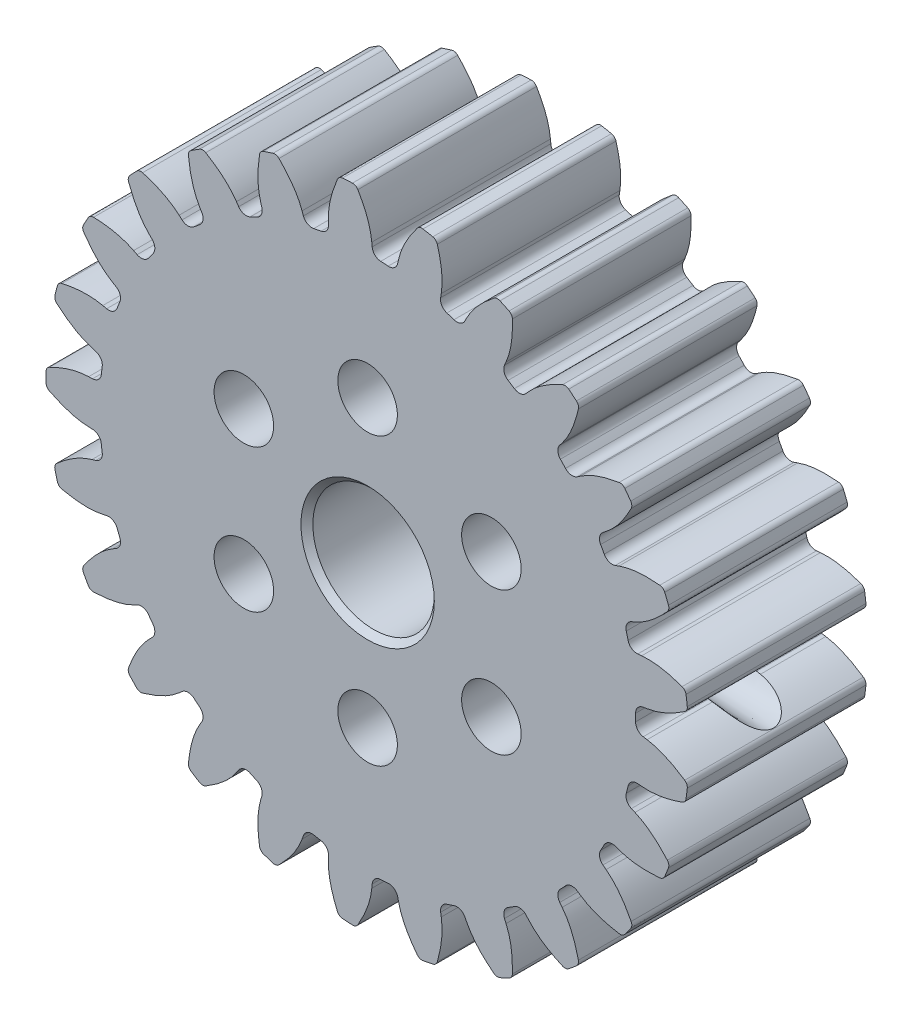
from build123d import *

# Parameters (mm, degrees)
EXTRUDE_1_DEPTH          = 15
SKETCH_2_R               = 5.1
CUT_EXTRUDE_1_DEPTH      = 42.004926924
CUT_EXTRUDE_2_DEPTH      = 42.004926924
CUT_EXTRUDE_2_DEPTH_BACK = 10
SKETCH_3_R               = 1.4
SKETCH_4_R               = 1.6
CUT_EXTRUDE_3_DEPTH      = 49.180950946
CUT_EXTRUDE_3_DRAFT      = -3
CHAMFER_1_SIZE           = 0.5
SKETCH_5_R               = 2.5
CUT_EXTRUDE_4_DEPTH      = 42.004926924


with BuildPart() as part:
    # Model → 凸台-拉伸1 (new body)
    with BuildSketch(Plane.XY):
        with BuildLine():
            Line((22.679018285, 4.714328783), (23.00803201, 4.745455879))
            add(Edge.make_bspline(
                [(23.00803201, 4.745455879), (23.302660102, 4.773329845), (23.909366678, 4.779909718), (24.828242862, 4.659026535), (25.662825858, 4.450786507), (26.186283476, 4.27883704), (26.403196442, 4.201915887)],
                knots=[0, 0, 0, 0, 0.887831086, 1.811652672, 2.7734525, 3.463896477, 3.463896477, 3.463896477, 3.463896477], degree=3))
            ThreePointArc((26.403196442, 4.201915887), (26.623093745, 4.047250157), (26.731104521, 3.801059205))
            ThreePointArc((26.731104521, 3.801059205), (26.759913246, 3.59263734), (26.787096935, 3.383997306))
            ThreePointArc((26.787096935, 3.383997306), (26.812653946, 3.175151711), (26.836582716, 2.966113299))
            ThreePointArc((26.836582716, 2.966113299), (26.793190457, 2.700795771), (26.618665461, 2.496302971))
            add(Edge.make_bspline(
                [(23.465339263, 1.125496228), (23.757643045, 1.171769001), (24.346925166, 1.316277637), (25.206870739, 1.661878267), (25.963446587, 2.071128403), (26.427696728, 2.367854377), (26.618665461, 2.496302971)],
                knots=[0, 0, 0, 0, 0.887831086, 1.811652672, 2.7734525, 3.463896477, 3.463896477, 3.463896477, 3.463896477], degree=3))
            Line((23.465339263, 1.125496228), (23.138921114, 1.073823023))
            ThreePointArc((23.138921114, 1.073823023), (22.676450538, 0.812749154), (22.497828137, 0.312616534))
            ThreePointArc((22.497828137, 0.312616534), (22.499457028, 0.156312039), (22.5, 0))
            ThreePointArc((22.5, 0), (22.499457045, -0.156309633), (22.497828204, -0.312611722))
            ThreePointArc((22.497828204, -0.312611722), (22.676448988, -0.812747314), (23.138921114, -1.073823023))
            Line((23.138921114, -1.073823023), (23.465339263, -1.125496228))
            add(Edge.make_bspline(
                [(23.465339263, -1.125496228), (23.757643045, -1.171769001), (24.346925166, -1.316277637), (25.206870739, -1.661878267), (25.963446587, -2.071128403), (26.427696728, -2.367854377), (26.618665461, -2.496302971)],
                knots=[0, 0, 0, 0, 0.887831086, 1.811652672, 2.7734525, 3.463896477, 3.463896477, 3.463896477, 3.463896477], degree=3))
            ThreePointArc((26.618665461, -2.496302971), (26.793190484, -2.700795829), (26.836582702, -2.966113426))
            ThreePointArc((26.836582702, -2.966113426), (26.812653938, -3.175151774), (26.787096935, -3.383997306))
            ThreePointArc((26.787096935, -3.383997306), (26.759913238, -3.592637403), (26.731104503, -3.801059332))
            ThreePointArc((26.731104503, -3.801059332), (26.623093705, -4.047250207), (26.403196442, -4.201915887))
            add(Edge.make_bspline(
                [(23.00803201, -4.745455879), (23.302660102, -4.773329845), (23.909366678, -4.779909718), (24.828242862, -4.659026535), (25.662825858, -4.450786507), (26.186283476, -4.27883704), (26.403196442, -4.201915887)],
                knots=[0, 0, 0, 0, 0.887831086, 1.811652672, 2.7734525, 3.463896477, 3.463896477, 3.463896477, 3.463896477], degree=3))
            Line((23.00803201, -4.745455879), (22.679018285, -4.714328783))
            ThreePointArc((22.679018285, -4.714328783), (22.16615064, -4.852188781), (21.868762066, -5.29218723))
            ThreePointArc((21.868762066, -5.29218723), (21.831468435, -5.44398622), (21.793121125, -5.595522461))
            ThreePointArc((21.793121125, -5.595522461), (21.753722603, -5.746786312), (21.713274187, -5.897772808))
            ThreePointArc((21.713274187, -5.897772808), (21.761904606, -6.426616902), (22.144920432, -6.794502579))
            Line((22.144920432, -6.794502579), (22.44823295, -6.925729268))
            add(Edge.make_bspline(
                [(22.44823295, -6.925729268), (22.719845901, -7.043241292), (23.254676804, -7.329758426), (24.001658224, -7.878361145), (24.63268848, -8.462906698), (25.0085606, -8.865764794), (25.161585833, -9.037669933)],
                knots=[0, 0, 0, 0, 0.887831086, 1.811652672, 2.7734525, 3.463896477, 3.463896477, 3.463896477, 3.463896477], degree=3))
            ThreePointArc((25.161585833, -9.037669933), (25.279772526, -9.279140879), (25.255819694, -9.546914243))
            ThreePointArc((25.255819694, -9.546914243), (25.180656973, -9.743434425), (25.103965119, -9.939362922))
            ThreePointArc((25.103965119, -9.939362922), (25.025748765, -10.134687896), (24.946012684, -10.329397426))
            ThreePointArc((24.946012684, -10.329397426), (24.780170063, -10.540992568), (24.528717485, -10.636112917))
            add(Edge.make_bspline(
                [(21.105045488, -10.318233541), (21.383485324, -10.418502822), (21.969494749, -10.575757766), (22.889565173, -10.687187565), (23.749715399, -10.693042131), (24.299489727, -10.656673389), (24.528717485, -10.636112917)],
                knots=[0, 0, 0, 0, 0.887831086, 1.811652672, 2.7734525, 3.463896477, 3.463896477, 3.463896477, 3.463896477], degree=3))
            Line((21.105045488, -10.318233541), (20.794109328, -10.206261973))
            ThreePointArc((20.794109328, -10.206261973), (20.263069977, -10.212245849), (19.865601247, -10.564463407))
            ThreePointArc((19.865601247, -10.564463407), (19.79172839, -10.702218804), (19.716900301, -10.839457667))
            ThreePointArc((19.716900301, -10.839457667), (19.641121765, -10.976171272), (19.564395296, -11.112355137))
            ThreePointArc((19.564395296, -11.112355137), (19.479979723, -11.636678516), (19.759472955, -12.08825855))
            Line((19.759472955, -12.08825855), (20.020621603, -12.290793267))
            add(Edge.make_bspline(
                [(20.020621603, -12.290793267), (20.254477281, -12.472160828), (20.701251574, -12.882683537), (21.288333251, -13.599817618), (21.754167964, -14.32292944), (22.018044635, -14.806606604), (22.12351123, -15.011166854)],
                knots=[0, 0, 0, 0, 0.887831086, 1.811652672, 2.7734525, 3.463896477, 3.463896477, 3.463896477, 3.463896477], degree=3))
            ThreePointArc((22.12351123, -15.011166854), (22.177933487, -15.274443382), (22.088140651, -15.527847327))
            ThreePointArc((22.088140651, -15.527847327), (21.966466723, -15.699501257), (21.843458848, -15.870201812))
            ThreePointArc((21.843458848, -15.870201812), (21.719124459, -16.039938676), (21.593471142, -16.208701491))
            ThreePointArc((21.593471142, -16.208701491), (21.3802172, -16.3724056), (21.113008999, -16.402003855))
            add(Edge.make_bspline(
                [(17.87595134, -15.242678642), (18.12070752, -15.40904295), (18.649198667, -15.707092058), (19.512651923, -16.043833295), (20.344322976, -16.263414592), (20.88586967, -16.364911757), (21.113008999, -16.402003855)],
                knots=[0, 0, 0, 0, 0.887831086, 1.811652672, 2.7734525, 3.463896477, 3.463896477, 3.463896477, 3.463896477], degree=3))
            Line((17.87595134, -15.242678642), (17.602630008, -15.056898188))
            ThreePointArc((17.602630008, -15.056898188), (17.086786105, -14.930629953), (16.614211641, -15.172935495))
            ThreePointArc((16.614211641, -15.172935495), (16.508401261, -15.287991621), (16.401794117, -15.402309883))
            ThreePointArc((16.401794117, -15.402309883), (16.294397013, -15.515883023), (16.186213496, -15.628707325))
            ThreePointArc((16.186213496, -15.628707325), (15.974056072, -16.115564821), (16.132465122, -16.622464779))
            Line((16.132465122, -16.622464779), (16.335040969, -16.883581522))
            add(Edge.make_bspline(
                [(16.335040969, -16.883581522), (16.516445363, -17.117408631), (16.847090573, -17.626142263), (17.237384007, -18.466747533), (17.508753068, -19.28298985), (17.644053949, -19.817094866), (17.695335051, -20.041456955)],
                knots=[0, 0, 0, 0, 0.887831086, 1.811652672, 2.7734525, 3.463896477, 3.463896477, 3.463896477, 3.463896477], degree=3))
            ThreePointArc((17.695335051, -20.041456955), (17.682573323, -20.309996432), (17.532582495, -20.533108655))
            ThreePointArc((17.532582495, -20.533108655), (17.372042581, -20.669110686), (17.210447723, -20.803857555))
            ThreePointArc((17.210447723, -20.803857555), (17.047807686, -20.937341118), (16.884132394, -21.06955323))
            ThreePointArc((16.884132394, -21.06955323), (16.63686666, -21.175080174), (16.370692509, -21.137296568))
            add(Edge.make_bspline(
                [(13.523645425, -19.209370184), (13.719339019, -19.431376239), (14.157104845, -19.85149199), (14.909686989, -20.392385974), (15.660621919, -20.811896902), (16.15991361, -21.044882532), (16.370692509, -21.137296568)],
                knots=[0, 0, 0, 0, 0.887831086, 1.811652672, 2.7734525, 3.463896477, 3.463896477, 3.463896477, 3.463896477], degree=3))
            Line((13.523645425, -19.209370184), (13.305112706, -18.961454114))
            ThreePointArc((13.305112706, -18.961454114), (12.83687662, -18.710867666), (12.318890015, -18.828036244))
            ThreePointArc((12.318890015, -18.828036244), (12.187790568, -18.913163698), (12.056102887, -18.997378324))
            ThreePointArc((12.056102887, -18.997378324), (11.923835369, -19.080674781), (11.790992374, -19.163050353))
            ThreePointArc((11.790992374, -19.163050353), (11.464423729, -19.58185092), (11.491795174, -20.112220412))
            Line((11.491795174, -20.112220412), (11.623069635, -20.415512257))
            add(Edge.make_bspline(
                [(11.623069635, -20.415512257), (11.740624439, -20.687106696), (11.934364913, -21.262085645), (12.10334653, -22.173343785), (12.163198824, -23.03142909), (12.161422463, -23.582402176), (12.155295892, -23.812468609)],
                knots=[0, 0, 0, 0, 0.887831086, 1.811652672, 2.7734525, 3.463896477, 3.463896477, 3.463896477, 3.463896477], degree=3))
            ThreePointArc((12.155295892, -23.812468609), (12.076152045, -24.069397711), (11.875387701, -24.248199251))
            ThreePointArc((11.875387701, -24.248199251), (11.686069114, -24.340003876), (11.496040872, -24.430330417))
            ThreePointArc((11.496040872, -24.430330417), (11.305314458, -24.519173416), (11.113901512, -24.606527451))
            ThreePointArc((11.113901512, -24.606527451), (10.848160602, -24.647246585), (10.599745202, -24.544455201))
            add(Edge.make_bspline(
                [(8.321599132, -21.969066351), (8.455933992, -22.232764695), (8.775468061, -22.748549672), (9.369891589, -23.459610045), (9.992906392, -24.052691188), (10.418570746, -24.402525941), (10.599745202, -24.544455201)],
                knots=[0, 0, 0, 0, 0.887831086, 1.811652672, 2.7734525, 3.463896477, 3.463896477, 3.463896477, 3.463896477], degree=3))
            Line((8.321599132, -21.969066351), (8.17158624, -21.674592143))
            ThreePointArc((8.17158624, -21.674592143), (7.780378967, -21.315432749), (7.249527223, -21.300102231))
            ThreePointArc((7.249527223, -21.300102231), (7.101376169, -21.349952143), (6.952882373, -21.398771617))
            ThreePointArc((6.952882373, -21.398771617), (6.804055296, -21.446557568), (6.654899836, -21.493308451))
            ThreePointArc((6.654899836, -21.493308451), (6.23443948, -21.817737308), (6.129053472, -22.338251269))
            Line((6.129053472, -22.338251269), (6.18077809, -22.664661274))
            add(Edge.make_bspline(
                [(6.18077809, -22.664661274), (6.227096903, -22.956957765), (6.271759213, -23.56205399), (6.208811278, -24.486707299), (6.053386064, -25.332718936), (5.914644077, -25.865940426), (5.851494788, -26.087255283)],
                knots=[0, 0, 0, 0, 0.887831086, 1.811652672, 2.7734525, 3.463896477, 3.463896477, 3.463896477, 3.463896477], degree=3))
            ThreePointArc((5.851494788, -26.087255283), (5.710941721, -26.316430211), (5.472018624, -26.43968631))
            ThreePointArc((5.472018624, -26.43968631), (5.265816946, -26.481525105), (5.059295494, -26.52175577))
            ThreePointArc((5.059295494, -26.52175577), (4.852466745, -26.560375872), (4.645343324, -26.597383056))
            ThreePointArc((4.645343324, -26.597383056), (4.377824716, -26.570735846), (4.162776921, -26.409395445))
            add(Edge.make_bspline(
                [(2.596676161, -23.348365283), (2.661211533, -23.637186779), (2.842436343, -24.216232314), (3.241351439, -25.052780538), (3.697299804, -25.782166428), (4.022590764, -26.226868899), (4.162776921, -26.409395445)],
                knots=[0, 0, 0, 0, 0.887831086, 1.811652672, 2.7734525, 3.463896477, 3.463896477, 3.463896477, 3.463896477], degree=3))
            Line((2.596676161, -23.348365283), (2.524608957, -23.025835834))
            ThreePointArc((2.524608957, -23.025835834), (2.23501149, -22.580670801), (1.724649974, -22.433804458))
            ThreePointArc((1.724649974, -22.433804458), (1.568756189, -22.445244575), (1.412786689, -22.45560139))
            ThreePointArc((1.412786689, -22.45560139), (1.256751405, -22.464874269), (1.100655467, -22.473062932))
            ThreePointArc((1.100655467, -22.473062932), (0.61272247, -22.682735021), (0.381200799, -23.160687645))
            Line((0.381200799, -23.160687645), (0.350125525, -23.489706269))
            add(Edge.make_bspline(
                [(0.350125525, -23.489706269), (0.322297967, -23.784338748), (0.215075817, -24.381531827), (-0.07584642, -25.261480938), (-0.436783204, -26.042260885), (-0.703773149, -26.524226512), (-0.819977254, -26.722883766)],
                knots=[0, 0, 0, 0, 0.887831086, 1.811652672, 2.7734525, 3.463896477, 3.463896477, 3.463896477, 3.463896477], degree=3))
            ThreePointArc((-0.819977254, -26.722883766), (-1.013108075, -26.909904616), (-1.275177509, -26.96987064))
            ThreePointArc((-1.275177509, -26.96987064), (-1.485305867, -26.95911472), (-1.695344027, -26.946721668))
            ThreePointArc((-1.695344027, -26.946721668), (-1.905279299, -26.932692231), (-2.11509887, -26.917027265))
            ThreePointArc((-2.11509887, -26.917027265), (-2.367585998, -26.824688054), (-2.535753944, -26.614936246))
            add(Edge.make_bspline(
                [(-3.291405523, -23.260600555), (-3.300724634, -23.556397487), (-3.269196103, -24.162320019), (-3.090854742, -25.071792692), (-2.830621728, -25.89165333), (-2.626143389, -26.403281228), (-2.535753944, -26.614936246)],
                knots=[0, 0, 0, 0, 0.887831086, 1.811652672, 2.7734525, 3.463896477, 3.463896477, 3.463896477, 3.463896477], degree=3))
            Line((-3.291405523, -23.260600555), (-3.280998791, -22.930281576))
            ThreePointArc((-3.280998791, -22.930281576), (-3.45078998, -22.42708226), (-3.908593376, -22.157908246))
            ThreePointArc((-3.908593376, -22.157908246), (-4.062434512, -22.130219742), (-4.216079578, -22.101463141))
            ThreePointArc((-4.216079578, -22.101463141), (-4.369518798, -22.071640299), (-4.522747133, -22.040752219))
            ThreePointArc((-4.522747133, -22.040752219), (-5.047494146, -22.122493072), (-5.390604122, -22.527852837))
            Line((-5.390604122, -22.527852837), (-5.502526713, -22.838806629))
            add(Edge.make_bspline(
                [(-5.502526713, -22.838806629), (-5.602752136, -23.117262255), (-5.855121584, -23.669028351), (-6.35573841, -24.448982824), (-6.899507777, -25.115471805), (-7.27796972, -25.515897896), (-7.439927109, -25.679415182)],
                knots=[0, 0, 0, 0, 0.887831086, 1.811652672, 2.7734525, 3.463896477, 3.463896477, 3.463896477, 3.463896477], degree=3))
            ThreePointArc((-7.439927109, -25.679415182), (-7.673500564, -25.812530746), (-7.942249549, -25.805438809))
            ThreePointArc((-7.942249549, -25.805438809), (-8.143101449, -25.742764008), (-8.343458848, -25.67852594))
            ThreePointArc((-8.343458848, -25.67852594), (-8.543309638, -25.612728485), (-8.742641623, -25.545375657))
            ThreePointArc((-8.742641623, -25.545375657), (-8.964232575, -25.393146457), (-9.074954063, -25.14816272))
            add(Edge.make_bspline(
                [(-8.972676093, -21.711286747), (-9.055264133, -21.995473105), (-9.175412935, -22.590200294), (-9.228851152, -23.515451904), (-9.180684886, -24.374272431), (-9.109867294, -24.920678293), (-9.074954063, -25.14816272)],
                knots=[0, 0, 0, 0, 0.887831086, 1.811652672, 2.7734525, 3.463896477, 3.463896477, 3.463896477, 3.463896477], degree=3))
            Line((-8.972676093, -21.711286747), (-8.880449319, -21.393933395))
            ThreePointArc((-8.880449319, -21.393933395), (-8.919765624, -20.864317659), (-9.296245429, -20.489749167))
            ThreePointArc((-9.296245429, -20.489749167), (-9.438367512, -20.424671814), (-9.58003406, -20.35860868))
            ThreePointArc((-9.58003406, -20.35860868), (-9.721236065, -20.291563995), (-9.861968898, -20.223539983))
            ThreePointArc((-9.861968898, -20.223539983), (-10.390558141, -20.172213522), (-10.823697561, -20.479510183))
            Line((-10.823697561, -20.479510183), (-11.009434962, -20.752860774))
            add(Edge.make_bspline(
                [(-11.009434962, -20.752860774), (-11.175760717, -20.997643155), (-11.557420163, -21.469312775), (-12.23627598, -22.100265202), (-12.928710902, -22.610585263), (-13.394864687, -22.904311575), (-13.592398982, -23.022414499)],
                knots=[0, 0, 0, 0, 0.887831086, 1.811652672, 2.7734525, 3.463896477, 3.463896477, 3.463896477, 3.463896477], degree=3))
            ThreePointArc((-13.592398982, -23.022414499), (-13.851738792, -23.093260637), (-14.11028084, -23.019556351))
            ThreePointArc((-14.11028084, -23.019556351), (-14.28923602, -22.908900759), (-14.467323464, -22.796853989))
            ThreePointArc((-14.467323464, -22.796853989), (-14.644532413, -22.683422811), (-14.820852049, -22.568614147))
            ThreePointArc((-14.820852049, -22.568614147), (-14.997623452, -22.366060079), (-15.043941443, -22.101237642))
            add(Edge.make_bspline(
                [(-14.090160425, -18.797772944), (-14.240828084, -19.052492255), (-14.505104827, -19.598655204), (-14.786964903, -20.481548789), (-14.953891849, -21.325366353), (-15.021184734, -21.872217489), (-15.043941443, -22.101237642)],
                knots=[0, 0, 0, 0, 0.887831086, 1.811652672, 2.7734525, 3.463896477, 3.463896477, 3.463896477, 3.463896477], degree=3))
            Line((-14.090160425, -18.797772944), (-13.921908555, -18.513325698))
            ThreePointArc((-13.921908555, -18.513325698), (-13.828279589, -17.990571247), (-14.099780193, -17.534143792))
            ThreePointArc((-14.099780193, -17.534143792), (-14.22125317, -17.435766639), (-14.342039769, -17.336547962))
            ThreePointArc((-14.342039769, -17.336547962), (-14.462132319, -17.236494098), (-14.581526886, -17.135608354))
            ThreePointArc((-14.581526886, -17.135608354), (-15.080745155, -16.954439609), (-15.576698275, -17.144364586))
            Line((-15.576698275, -17.144364586), (-15.824579922, -17.362936352))
            add(Edge.make_bspline(
                [(-15.824579922, -17.362936352), (-16.04655515, -17.558664912), (-16.533523527, -17.920601318), (-17.347963328, -18.362906638), (-18.145555573, -18.684992494), (-18.670111042, -18.853563121), (-18.890810437, -18.918830844)],
                knots=[0, 0, 0, 0, 0.887831086, 1.811652672, 2.7734525, 3.463896477, 3.463896477, 3.463896477, 3.463896477], degree=3))
            ThreePointArc((-18.890810437, -18.918830844), (-19.159621328, -18.922956031), (-19.391711292, -18.787270509))
            ThreePointArc((-19.391711292, -18.787270509), (-19.537525339, -18.635587021), (-19.68215294, -18.48277186))
            ThreePointArc((-19.68215294, -18.48277186), (-19.825585357, -18.328834258), (-19.967813834, -18.173783609))
            ThreePointArc((-19.967813834, -18.173783609), (-20.08865849, -17.933631889), (-20.067662654, -17.66561052))
            add(Edge.make_bspline(
                [(-18.322308158, -14.703125934), (-18.531588432, -14.912373247), (-18.923387637, -15.375654528), (-19.415959267, -16.160714638), (-19.787490791, -16.936509078), (-19.988665893, -17.44944482), (-20.067662654, -17.66561052)],
                knots=[0, 0, 0, 0, 0.887831086, 1.811652672, 2.7734525, 3.463896477, 3.463896477, 3.463896477, 3.463896477], degree=3))
            Line((-18.322308158, -14.703125934), (-18.088603076, -14.46945766))
            ThreePointArc((-18.088603076, -14.46945766), (-17.86791189, -13.986411078), (-18.017373911, -13.476803677))
            ThreePointArc((-18.017373911, -13.476803677), (-18.110565188, -13.351308122), (-18.202882373, -13.225168177))
            ThreePointArc((-18.202882373, -13.225168177), (-18.29431961, -13.098391886), (-18.384873914, -12.970983431))
            ThreePointArc((-18.384873914, -12.970983431), (-18.823353488, -12.6713559), (-19.35095775, -12.73197551))
            Line((-19.35095775, -12.73197551), (-19.645408326, -12.882034783))
            add(Edge.make_bspline(
                [(-19.645408326, -12.882034783), (-19.909085508, -13.016411176), (-20.470764803, -13.245872574), (-21.36961434, -13.471739117), (-22.222248252, -13.585352927), (-22.772245657, -13.618175958), (-23.002242797, -13.626507467)],
                knots=[0, 0, 0, 0, 0.887831086, 1.811652672, 2.7734525, 3.463896477, 3.463896477, 3.463896477, 3.463896477], degree=3))
            ThreePointArc((-23.002242797, -13.626507467), (-23.263634392, -13.563652505), (-23.454689206, -13.374511365))
            ThreePointArc((-23.454689206, -13.374511365), (-23.558200087, -13.191330815), (-23.660280361, -13.007349201))
            ThreePointArc((-23.660280361, -13.007349201), (-23.76092386, -12.82257764), (-23.86012444, -12.637027408))
            ThreePointArc((-23.86012444, -12.637027408), (-23.917449234, -12.374367653), (-23.830458817, -12.11998812))
            add(Edge.make_bspline(
                [(-21.403197884, -9.684627447), (-21.657940924, -9.835254983), (-22.152644407, -10.186544931), (-22.824977503, -10.824443351), (-23.377768913, -11.483468649), (-23.700185661, -11.930259358), (-23.830458817, -12.11998812)],
                knots=[0, 0, 0, 0, 0.887831086, 1.811652672, 2.7734525, 3.463896477, 3.463896477, 3.463896477, 3.463896477], degree=3))
            Line((-21.403197884, -9.684627447), (-21.118724141, -9.516420382))
            ThreePointArc((-21.118724141, -9.516420382), (-20.784837574, -9.103433263), (-20.802869764, -8.572666422))
            ThreePointArc((-20.802869764, -8.572666422), (-20.86192379, -8.427937812), (-20.919970932, -8.282802435))
            ThreePointArc((-20.919970932, -8.282802435), (-20.977007519, -8.137269539), (-21.033031698, -7.991343916))
            ThreePointArc((-21.033031698, -7.991343916), (-21.383221293, -7.592084299), (-21.909325381, -7.519589588))
            Line((-21.909325381, -7.519589588), (-22.231843475, -7.591707592))
            add(Edge.make_bspline(
                [(-22.231843475, -7.591707592), (-22.520654803, -7.656288455), (-23.121752639, -7.73885694), (-24.04853389, -7.734092681), (-24.902635346, -7.632095673), (-25.443516327, -7.527108715), (-25.668359646, -7.477980512)],
                knots=[0, 0, 0, 0, 0.887831086, 1.811652672, 2.7734525, 3.463896477, 3.463896477, 3.463896477, 3.463896477], degree=3))
            ThreePointArc((-25.668359646, -7.477980512), (-25.90590775, -7.352094807), (-26.043922737, -7.121382484))
            ThreePointArc((-26.043922737, -7.121382484), (-26.098626483, -6.918214778), (-26.15174535, -6.714626953))
            ThreePointArc((-26.15174535, -6.714626953), (-26.20327613, -6.510631311), (-26.253215675, -6.3062403))
            ThreePointArc((-26.253215675, -6.3062403), (-26.24341868, -6.037576387), (-26.09589961, -5.812822292))
            add(Edge.make_bspline(
                [(-23.139245972, -4.0576082), (-23.423445336, -4.140151478), (-23.989969056, -4.357377253), (-24.799818458, -4.808032478), (-25.499135836, -5.308879652), (-25.9225356, -5.661451824), (-26.09589961, -5.812822292)],
                knots=[0, 0, 0, 0, 0.887831086, 1.811652672, 2.7734525, 3.463896477, 3.463896477, 3.463896477, 3.463896477], degree=3))
            Line((-23.139245972, -4.0576082), (-22.821878098, -3.965431412))
            ThreePointArc((-22.821878098, -3.965431412), (-22.395775472, -3.648453256), (-22.281244802, -3.129877008))
            ThreePointArc((-22.281244802, -3.129877008), (-22.302450996, -2.975009175), (-22.32258078, -2.819997755))
            ThreePointArc((-22.32258078, -2.819997755), (-22.341632897, -2.66485262), (-22.359606747, -2.509578872))
            ThreePointArc((-22.359606747, -2.509578872), (-22.599502663, -2.035774119), (-23.091049522, -1.834720196))
            Line((-23.091049522, -1.834720196), (-23.421370135, -1.824365493))
            add(Edge.make_bspline(
                [(-23.421370135, -1.824365493), (-23.717168532, -1.815092972), (-24.319915721, -1.745580464), (-25.216395612, -1.510484757), (-26.018298276, -1.199285779), (-26.516077291, -0.963085549), (-26.721639057, -0.859584539)],
                knots=[0, 0, 0, 0, 0.887831086, 1.811652672, 2.7734525, 3.463896477, 3.463896477, 3.463896477, 3.463896477], degree=3))
            ThreePointArc((-26.721639057, -0.859584539), (-26.920417648, -0.678577954), (-26.996720819, -0.420790952))
            ThreePointArc((-26.996720819, -0.420790952), (-26.999180192, -0.210401864), (-27, 0))
            ThreePointArc((-27, 0), (-26.999180192, 0.210401928), (-26.996720817, 0.42079108))
            ThreePointArc((-26.996720817, 0.42079108), (-26.920417615, 0.678578008), (-26.721639057, 0.859584539))
            add(Edge.make_bspline(
                [(-23.421370135, 1.824365493), (-23.717168532, 1.815092972), (-24.319915721, 1.745580464), (-25.216395612, 1.510484757), (-26.018298276, 1.199285779), (-26.516077291, 0.963085549), (-26.721639057, 0.859584539)],
                knots=[0, 0, 0, 0, 0.887831086, 1.811652672, 2.7734525, 3.463896477, 3.463896477, 3.463896477, 3.463896477], degree=3))
            Line((-23.421370135, 1.824365493), (-23.091049522, 1.834720196))
            ThreePointArc((-23.091049522, 1.834720196), (-22.599504432, 2.035772487), (-22.359607284, 2.509574089))
            ThreePointArc((-22.359607284, 2.509574089), (-22.341633182, 2.664850231), (-22.32258078, 2.819997755))
            ThreePointArc((-22.32258078, 2.819997755), (-22.302451314, 2.97500679), (-22.281245471, 3.129872242))
            ThreePointArc((-22.281245471, 3.129872242), (-22.395774165, 3.648451236), (-22.821878098, 3.965431413))
            Line((-22.821878098, 3.965431413), (-23.139245972, 4.0576082))
            add(Edge.make_bspline(
                [(-23.139245972, 4.0576082), (-23.423445336, 4.140151478), (-23.989969056, 4.357377253), (-24.799818458, 4.808032478), (-25.499135836, 5.308879652), (-25.9225356, 5.661451824), (-26.09589961, 5.812822292)],
                knots=[0, 0, 0, 0, 0.887831086, 1.811652672, 2.7734525, 3.463896477, 3.463896477, 3.463896477, 3.463896477], degree=3))
            ThreePointArc((-26.09589961, 5.812822292), (-26.2434187, 6.037576448), (-26.253215645, 6.306240424))
            ThreePointArc((-26.253215645, 6.306240424), (-26.203276114, 6.510631373), (-26.15174535, 6.714626953))
            ThreePointArc((-26.15174535, 6.714626953), (-26.098626466, 6.91821484), (-26.043922703, 7.121382608))
            ThreePointArc((-26.043922703, 7.121382608), (-25.905907704, 7.352094851), (-25.668359646, 7.477980512))
            add(Edge.make_bspline(
                [(-22.231843475, 7.591707592), (-22.520654803, 7.656288455), (-23.121752639, 7.738856941), (-24.04853389, 7.734092681), (-24.902635346, 7.632095673), (-25.443516327, 7.527108715), (-25.668359646, 7.477980512)],
                knots=[0, 0, 0, 0, 0.887831086, 1.811652672, 2.7734525, 3.463896477, 3.463896477, 3.463896477, 3.463896477], degree=3))
            Line((-22.231843475, 7.591707592), (-21.909325381, 7.519589588))
            ThreePointArc((-21.909325381, 7.519589588), (-21.383223412, 7.592083158), (-21.033033407, 7.991339417))
            ThreePointArc((-21.033033407, 7.991339417), (-20.977008389, 8.137267296), (-20.919970932, 8.282802435))
            ThreePointArc((-20.919970932, 8.282802435), (-20.861924691, 8.427935581), (-20.802871598, 8.572661972))
            ThreePointArc((-20.802871598, 8.572661972), (-20.784836811, 9.103430981), (-21.118724141, 9.516420382))
            Line((-21.118724141, 9.516420382), (-21.403197884, 9.684627447))
            add(Edge.make_bspline(
                [(-21.403197884, 9.684627447), (-21.657940924, 9.835254983), (-22.152644407, 10.186544931), (-22.824977503, 10.824443351), (-23.377768913, 11.483468649), (-23.700185661, 11.930259358), (-23.830458817, 12.11998812)],
                knots=[0, 0, 0, 0, 0.887831086, 1.811652672, 2.7734525, 3.463896477, 3.463896477, 3.463896477, 3.463896477], degree=3))
            ThreePointArc((-23.830458817, 12.11998812), (-23.917449237, 12.374367716), (-23.86012438, 12.637027521))
            ThreePointArc((-23.86012438, 12.637027521), (-23.760923829, 12.822577696), (-23.660280361, 13.007349201))
            ThreePointArc((-23.660280361, 13.007349201), (-23.558200056, 13.19133087), (-23.454689143, 13.374511476))
            ThreePointArc((-23.454689143, 13.374511476), (-23.263634337, 13.563652536), (-23.002242797, 13.626507467))
            add(Edge.make_bspline(
                [(-19.645408326, 12.882034783), (-19.909085508, 13.016411176), (-20.470764803, 13.245872574), (-21.36961434, 13.471739117), (-22.222248252, 13.585352927), (-22.772245657, 13.618175958), (-23.002242797, 13.626507467)],
                knots=[0, 0, 0, 0, 0.887831086, 1.811652672, 2.7734525, 3.463896477, 3.463896477, 3.463896477, 3.463896477], degree=3))
            Line((-19.645408326, 12.882034783), (-19.35095775, 12.73197551))
            ThreePointArc((-19.35095775, 12.73197551), (-18.823355824, 12.671355322), (-18.384876688, 12.970979499))
            ThreePointArc((-18.384876688, 12.970979499), (-18.294321011, 13.098389929), (-18.202882373, 13.225168177))
            ThreePointArc((-18.202882373, 13.225168177), (-18.110566616, 13.351306185), (-18.017376794, 13.476799823))
            ThreePointArc((-18.017376794, 13.476799823), (-17.867911718, 13.986408678), (-18.088603076, 14.46945766))
            Line((-18.088603076, 14.46945766), (-18.322308158, 14.703125934))
            add(Edge.make_bspline(
                [(-18.322308158, 14.703125934), (-18.531588432, 14.912373247), (-18.923387637, 15.375654528), (-19.415959267, 16.160714638), (-19.787490791, 16.936509078), (-19.988665893, 17.44944482), (-20.067662654, 17.66561052)],
                knots=[0, 0, 0, 0, 0.887831086, 1.811652672, 2.7734525, 3.463896477, 3.463896477, 3.463896477, 3.463896477], degree=3))
            ThreePointArc((-20.067662654, 17.66561052), (-20.088658477, 17.933631952), (-19.967813748, 18.173783704))
            ThreePointArc((-19.967813748, 18.173783704), (-19.825585314, 18.328834305), (-19.68215294, 18.48277186))
            ThreePointArc((-19.68215294, 18.48277186), (-19.537525295, 18.635587068), (-19.391711203, 18.7872706))
            ThreePointArc((-19.391711203, 18.7872706), (-19.159621266, 18.922956048), (-18.890810437, 18.918830844))
            add(Edge.make_bspline(
                [(-15.824579922, 17.362936352), (-16.04655515, 17.558664912), (-16.533523527, 17.920601318), (-17.347963328, 18.362906638), (-18.145555573, 18.684992494), (-18.670111042, 18.853563121), (-18.890810437, 18.918830844)],
                knots=[0, 0, 0, 0, 0.887831086, 1.811652672, 2.7734525, 3.463896477, 3.463896477, 3.463896477, 3.463896477], degree=3))
            Line((-15.824579922, 17.362936352), (-15.576698275, 17.144364586))
            ThreePointArc((-15.576698275, 17.144364586), (-15.080747561, 16.95443963), (-14.581530551, 17.135605235))
            ThreePointArc((-14.581530551, 17.135605235), (-14.462134162, 17.236492552), (-14.342039769, 17.336547962))
            ThreePointArc((-14.342039769, 17.336547962), (-14.221255034, 17.435765118), (-14.099783943, 17.534140776))
            ThreePointArc((-14.099783943, 17.534140776), (-13.828280019, 17.990568879), (-13.921908555, 18.513325698))
            Line((-13.921908555, 18.513325698), (-14.090160425, 18.797772944))
            add(Edge.make_bspline(
                [(-14.090160425, 18.797772944), (-14.240828084, 19.052492255), (-14.505104827, 19.598655204), (-14.786964903, 20.481548789), (-14.953891849, 21.325366353), (-15.021184734, 21.872217489), (-15.043941443, 22.101237642)],
                knots=[0, 0, 0, 0, 0.887831086, 1.811652672, 2.7734525, 3.463896477, 3.463896477, 3.463896477, 3.463896477], degree=3))
            ThreePointArc((-15.043941443, 22.101237642), (-14.997623424, 22.366060137), (-14.820851943, 22.568614217))
            ThreePointArc((-14.820851943, 22.568614217), (-14.644532359, 22.683422845), (-14.467323464, 22.796853989))
            ThreePointArc((-14.467323464, 22.796853989), (-14.289235966, 22.908900792), (-14.110280731, 23.019556418))
            ThreePointArc((-14.110280731, 23.019556418), (-13.851738728, 23.093260637), (-13.592398982, 23.022414499))
            add(Edge.make_bspline(
                [(-11.009434962, 20.752860774), (-11.175760717, 20.997643155), (-11.557420163, 21.469312775), (-12.23627598, 22.100265202), (-12.928710902, 22.610585263), (-13.394864687, 22.904311575), (-13.592398982, 23.022414499)],
                knots=[0, 0, 0, 0, 0.887831086, 1.811652672, 2.7734525, 3.463896477, 3.463896477, 3.463896477, 3.463896477], degree=3))
            Line((-11.009434962, 20.752860774), (-10.823697561, 20.479510183))
            ThreePointArc((-10.823697561, 20.479510183), (-10.390560467, 20.172214141), (-9.861973223, 20.223537874))
            ThreePointArc((-9.861973223, 20.223537874), (-9.721238236, 20.291562955), (-9.58003406, 20.35860868))
            ThreePointArc((-9.58003406, 20.35860868), (-9.438369696, 20.424670804), (-9.296249812, 20.489747179))
            ThreePointArc((-9.296249812, 20.489747179), (-8.919766629, 20.864315473), (-8.880449319, 21.393933395))
            Line((-8.880449319, 21.393933395), (-8.972676093, 21.711286747))
            add(Edge.make_bspline(
                [(-8.972676093, 21.711286747), (-9.055264133, 21.995473105), (-9.175412935, 22.590200294), (-9.228851152, 23.515451904), (-9.180684886, 24.374272431), (-9.109867294, 24.920678293), (-9.074954063, 25.14816272)],
                knots=[0, 0, 0, 0, 0.887831086, 1.811652672, 2.7734525, 3.463896477, 3.463896477, 3.463896477, 3.463896477], degree=3))
            ThreePointArc((-9.074954063, 25.14816272), (-8.964232534, 25.393146506), (-8.742641502, 25.545375698))
            ThreePointArc((-8.742641502, 25.545375698), (-8.543309578, 25.612728505), (-8.343458848, 25.67852594))
            ThreePointArc((-8.343458848, 25.67852594), (-8.143101389, 25.742764027), (-7.942249427, 25.805438846))
            ThreePointArc((-7.942249427, 25.805438846), (-7.673500502, 25.81253073), (-7.439927109, 25.679415182))
            add(Edge.make_bspline(
                [(-5.502526713, 22.838806629), (-5.602752136, 23.117262255), (-5.855121584, 23.669028351), (-6.35573841, 24.448982824), (-6.899507777, 25.115471805), (-7.27796972, 25.515897896), (-7.439927109, 25.679415182)],
                knots=[0, 0, 0, 0, 0.887831086, 1.811652672, 2.7734525, 3.463896477, 3.463896477, 3.463896477, 3.463896477], degree=3))
            Line((-5.502526713, 22.838806629), (-5.390604122, 22.527852837))
            ThreePointArc((-5.390604122, 22.527852837), (-5.047496244, 22.12249425), (-4.522751847, 22.040751251))
            ThreePointArc((-4.522751847, 22.040751251), (-4.369521159, 22.071639831), (-4.216079578, 22.101463141))
            ThreePointArc((-4.216079578, 22.101463141), (-4.062436879, 22.130219308), (-3.908598115, 22.15790741))
            ThreePointArc((-3.908598115, 22.15790741), (-3.450791497, 22.427080392), (-3.280998791, 22.930281576))
            Line((-3.280998791, 22.930281576), (-3.291405523, 23.260600555))
            add(Edge.make_bspline(
                [(-3.291405523, 23.260600555), (-3.300724634, 23.556397487), (-3.269196103, 24.162320019), (-3.090854742, 25.071792692), (-2.830621728, 25.89165333), (-2.626143389, 26.403281228), (-2.535753944, 26.614936246)],
                knots=[0, 0, 0, 0, 0.887831086, 1.811652672, 2.7734525, 3.463896477, 3.463896477, 3.463896477, 3.463896477], degree=3))
            ThreePointArc((-2.535753944, 26.614936246), (-2.367585946, 26.824688091), (-2.115098743, 26.917027275))
            ThreePointArc((-2.115098743, 26.917027275), (-1.905279235, 26.932692235), (-1.695344027, 26.946721668))
            ThreePointArc((-1.695344027, 26.946721668), (-1.485305803, 26.959114723), (-1.275177381, 26.969870646))
            ThreePointArc((-1.275177381, 26.969870646), (-1.013108018, 26.909904585), (-0.819977254, 26.722883766))
            add(Edge.make_bspline(
                [(0.350125525, 23.489706269), (0.322297967, 23.784338748), (0.215075817, 24.381531827), (-0.07584642, 25.261480938), (-0.436783204, 26.042260885), (-0.703773149, 26.524226512), (-0.819977254, 26.722883766)],
                knots=[0, 0, 0, 0, 0.887831086, 1.811652672, 2.7734525, 3.463896477, 3.463896477, 3.463896477, 3.463896477], degree=3))
            Line((0.350125525, 23.489706269), (0.381200799, 23.160687645))
            ThreePointArc((0.381200799, 23.160687645), (0.612720731, 22.682736684), (1.10065066, 22.473063167))
            ThreePointArc((1.10065066, 22.473063167), (1.256749003, 22.464874403), (1.412786689, 22.45560139))
            ThreePointArc((1.412786689, 22.45560139), (1.568753789, 22.445244742), (1.724645175, 22.433804827))
            ThreePointArc((1.724645175, 22.433804827), (2.235009556, 22.580669369), (2.524608957, 23.025835834))
            Line((2.524608957, 23.025835834), (2.596676161, 23.348365283))
            add(Edge.make_bspline(
                [(2.596676161, 23.348365283), (2.661211533, 23.637186779), (2.842436343, 24.216232314), (3.241351439, 25.052780538), (3.697299804, 25.782166428), (4.022590764, 26.226868899), (4.162776921, 26.409395445)],
                knots=[0, 0, 0, 0, 0.887831086, 1.811652672, 2.7734525, 3.463896477, 3.463896477, 3.463896477, 3.463896477], degree=3))
            ThreePointArc((4.162776921, 26.409395445), (4.377824775, 26.57073587), (4.645343449, 26.597383034))
            ThreePointArc((4.645343449, 26.597383034), (4.852466808, 26.560375861), (5.059295494, 26.52175577))
            ThreePointArc((5.059295494, 26.52175577), (5.265817009, 26.481525093), (5.472018749, 26.439686284))
            ThreePointArc((5.472018749, 26.439686284), (5.710941768, 26.316430168), (5.851494788, 26.087255283))
            add(Edge.make_bspline(
                [(6.18077809, 22.664661274), (6.227096903, 22.956957765), (6.271759214, 23.56205399), (6.208811278, 24.486707299), (6.053386064, 25.332718936), (5.914644077, 25.865940426), (5.851494788, 26.087255283)],
                knots=[0, 0, 0, 0, 0.887831086, 1.811652672, 2.7734525, 3.463896477, 3.463896477, 3.463896477, 3.463896477], degree=3))
            Line((6.18077809, 22.664661274), (6.129053472, 22.338251269))
            ThreePointArc((6.129053472, 22.338251269), (6.234438209, 21.817739351), (6.654895239, 21.493309874))
            ThreePointArc((6.654895239, 21.493309874), (6.804053002, 21.446558296), (6.952882373, 21.398771617))
            ThreePointArc((6.952882373, 21.398771617), (7.101373886, 21.349952902), (7.249522667, 21.300103781))
            ThreePointArc((7.249522667, 21.300103781), (7.780376738, 21.315431844), (8.17158624, 21.674592143))
            Line((8.17158624, 21.674592143), (8.321599132, 21.969066351))
            add(Edge.make_bspline(
                [(8.321599132, 21.969066351), (8.455933992, 22.232764695), (8.775468061, 22.748549672), (9.369891589, 23.459610045), (9.992906392, 24.052691188), (10.418570746, 24.402525941), (10.599745202, 24.544455201)],
                knots=[0, 0, 0, 0, 0.887831086, 1.811652672, 2.7734525, 3.463896477, 3.463896477, 3.463896477, 3.463896477], degree=3))
            ThreePointArc((10.599745202, 24.544455201), (10.848160665, 24.647246593), (11.113901628, 24.606527398))
            ThreePointArc((11.113901628, 24.606527398), (11.305314516, 24.519173389), (11.496040872, 24.430330417))
            ThreePointArc((11.496040872, 24.430330417), (11.686069171, 24.340003848), (11.875387816, 24.248199195))
            ThreePointArc((11.875387816, 24.248199195), (12.07615208, 24.069397658), (12.155295892, 23.812468609))
            add(Edge.make_bspline(
                [(11.623069635, 20.415512257), (11.740624439, 20.687106696), (11.934364913, 21.262085645), (12.10334653, 22.173343785), (12.163198824, 23.03142909), (12.161422463, 23.582402176), (12.155295892, 23.812468609)],
                knots=[0, 0, 0, 0, 0.887831086, 1.811652672, 2.7734525, 3.463896477, 3.463896477, 3.463896477, 3.463896477], degree=3))
            Line((11.623069635, 20.415512257), (11.491795174, 20.112220412))
            ThreePointArc((11.491795174, 20.112220412), (11.464423006, 19.581853215), (11.790988275, 19.163052875))
            ThreePointArc((11.790988275, 19.163052875), (11.923833328, 19.080676056), (12.056102887, 18.997378324))
            ThreePointArc((12.056102887, 18.997378324), (12.187788545, 18.913165002), (12.318885987, 18.828038879))
            ThreePointArc((12.318885987, 18.828038879), (12.836874236, 18.710867343), (13.305112706, 18.961454114))
            Line((13.305112706, 18.961454114), (13.523645425, 19.209370184))
            add(Edge.make_bspline(
                [(13.523645425, 19.209370184), (13.719339019, 19.431376239), (14.157104845, 19.85149199), (14.909686989, 20.392385974), (15.660621919, 20.811896902), (16.15991361, 21.044882532), (16.370692509, 21.137296568)],
                knots=[0, 0, 0, 0, 0.887831086, 1.811652672, 2.7734525, 3.463896477, 3.463896477, 3.463896477, 3.463896477], degree=3))
            ThreePointArc((16.370692509, 21.137296568), (16.636866723, 21.175080166), (16.884132494, 21.06955315))
            ThreePointArc((16.884132494, 21.06955315), (17.047807735, 20.937341078), (17.210447723, 20.803857555))
            ThreePointArc((17.210447723, 20.803857555), (17.37204263, 20.669110645), (17.532582592, 20.533108572))
            ThreePointArc((17.532582592, 20.533108572), (17.682573343, 20.309996372), (17.695335051, 20.041456955))
            add(Edge.make_bspline(
                [(16.335040969, 16.883581522), (16.516445363, 17.117408631), (16.847090573, 17.626142263), (17.237384007, 18.466747533), (17.508753068, 19.28298985), (17.644053949, 19.817094866), (17.695335051, 20.041456955)],
                knots=[0, 0, 0, 0, 0.887831086, 1.811652672, 2.7734525, 3.463896477, 3.463896477, 3.463896477, 3.463896477], degree=3))
            Line((16.335040969, 16.883581522), (16.132465122, 16.622464779))
            ThreePointArc((16.132465122, 16.622464779), (15.974055942, 16.115567224), (16.186210154, 15.628710787))
            ThreePointArc((16.186210154, 15.628710787), (16.294395353, 15.515884766), (16.401794117, 15.402309883))
            ThreePointArc((16.401794117, 15.402309883), (16.508399626, 15.287993386), (16.614208396, 15.172939049))
            ThreePointArc((16.614208396, 15.172939049), (17.086783715, 14.930630233), (17.602630008, 15.056898188))
            Line((17.602630008, 15.056898188), (17.87595134, 15.242678642))
            add(Edge.make_bspline(
                [(17.87595134, 15.242678642), (18.12070752, 15.40904295), (18.649198667, 15.707092058), (19.512651923, 16.043833295), (20.344322976, 16.263414592), (20.88586967, 16.364911757), (21.113008999, 16.402003855)],
                knots=[0, 0, 0, 0, 0.887831086, 1.811652672, 2.7734525, 3.463896477, 3.463896477, 3.463896477, 3.463896477], degree=3))
            ThreePointArc((21.113008999, 16.402003855), (21.380217259, 16.372405576), (21.593471219, 16.208701389))
            ThreePointArc((21.593471219, 16.208701389), (21.719124497, 16.039938625), (21.843458848, 15.870201812))
            ThreePointArc((21.843458848, 15.870201812), (21.96646676, 15.699501205), (22.088140724, 15.527847222))
            ThreePointArc((22.088140724, 15.527847222), (22.177933492, 15.274443319), (22.12351123, 15.011166854))
            add(Edge.make_bspline(
                [(20.020621603, 12.290793267), (20.254477281, 12.472160828), (20.701251574, 12.882683537), (21.288333251, 13.599817618), (21.754167964, 14.32292944), (22.018044635, 14.806606604), (22.12351123, 15.011166854)],
                knots=[0, 0, 0, 0, 0.887831086, 1.811652672, 2.7734525, 3.463896477, 3.463896477, 3.463896477, 3.463896477], degree=3))
            Line((20.020621603, 12.290793267), (19.759472955, 12.08825855))
            ThreePointArc((19.759472955, 12.08825855), (19.479980195, 11.636680875), (19.564392919, 11.112359322))
            ThreePointArc((19.564392919, 11.112359322), (19.641120592, 10.976173373), (19.716900301, 10.839457667))
            ThreePointArc((19.716900301, 10.839457667), (19.791727245, 10.702220921), (19.865598988, 10.564467656))
            ThreePointArc((19.865598988, 10.564467656), (20.263067732, 10.212246715), (20.794109328, 10.206261973))
            Line((20.794109328, 10.206261973), (21.105045488, 10.318233541))
            add(Edge.make_bspline(
                [(21.105045488, 10.318233541), (21.383485324, 10.418502822), (21.969494749, 10.575757766), (22.889565173, 10.687187565), (23.749715399, 10.693042131), (24.299489727, 10.656673389), (24.528717485, 10.636112917)],
                knots=[0, 0, 0, 0, 0.887831086, 1.811652672, 2.7734525, 3.463896477, 3.463896477, 3.463896477, 3.463896477], degree=3))
            ThreePointArc((24.528717485, 10.636112917), (24.780170114, 10.540992531), (24.946012733, 10.329397308))
            ThreePointArc((24.946012733, 10.329397308), (25.025748789, 10.134687837), (25.103965119, 9.939362922))
            ThreePointArc((25.103965119, 9.939362922), (25.180656996, 9.743434365), (25.25581974, 9.546914123))
            ThreePointArc((25.25581974, 9.546914123), (25.279772514, 9.279140817), (25.161585833, 9.037669933))
            add(Edge.make_bspline(
                [(22.44823295, 6.925729268), (22.719845901, 7.043241292), (23.254676804, 7.329758426), (24.001658224, 7.878361145), (24.63268848, 8.462906698), (25.0085606, 8.865764794), (25.161585833, 9.037669933)],
                knots=[0, 0, 0, 0, 0.887831086, 1.811652672, 2.7734525, 3.463896477, 3.463896477, 3.463896477, 3.463896477], degree=3))
            Line((22.44823295, 6.925729268), (22.144920432, 6.794502579))
            ThreePointArc((22.144920432, 6.794502579), (21.761905649, 6.42661907), (21.713272925, 5.897777452))
            ThreePointArc((21.713272925, 5.897777452), (21.753721988, 5.746788639), (21.793121125, 5.595522461))
            ThreePointArc((21.793121125, 5.595522461), (21.831467853, 5.443988555), (21.868760935, 5.292191908))
            ThreePointArc((21.868760935, 5.292191908), (22.166148681, 4.852190178), (22.679018285, 4.714328783))
        make_face()
    extrude(amount=EXTRUDE_1_DEPTH)

    # 草图2 → 切除-拉伸1 (cut, through all)
    with BuildSketch(Plane.XY.offset(15)):
        Circle(SKETCH_2_R)
    extrude(amount=-CUT_EXTRUDE_1_DEPTH, mode=Mode.SUBTRACT)

    # 草图3 → 切除-拉伸2 (cut, two sides: drawn at the far end of the back side and taken through both)
    with BuildSketch(Plane(origin=(0, 0, 0), x_dir=(0, 0, -1), z_dir=(1, 0, 0)).offset(-CUT_EXTRUDE_2_DEPTH_BACK)):
        with Locations((-7.5, 0)):
            Circle(SKETCH_3_R)
    extrude(amount=CUT_EXTRUDE_2_DEPTH + CUT_EXTRUDE_2_DEPTH_BACK, mode=Mode.SUBTRACT)


with BuildPart() as cut_extrude_3_tool:
    # 草图4 → 切除-拉伸3 (with draft: the straight prism first)
    with BuildSketch(Plane(origin=(10, 0, 0), x_dir=(0, 0, -1), z_dir=(1, 0, 0))):
        with Locations((-7.5, 0)):
            Circle(SKETCH_4_R)
    extrude(amount=CUT_EXTRUDE_3_DEPTH)
    # 切除-拉伸3: the draft: its side faces are tilted about the plane it starts from
    cut_extrude_3_sides = [cut_extrude_3_tool.faces().sort_by_distance(p)[0] for p in [
        (34.590475473, 0, 9.1),
    ]]
    draft(cut_extrude_3_sides, Plane(origin=(10, 0, 0), x_dir=(0, 0, -1), z_dir=(1, 0, 0)), CUT_EXTRUDE_3_DRAFT)


with BuildPart() as part_1:
    add(part.part)

    # 切除-拉伸3: cut by cut_extrude_3_tool
    add(cut_extrude_3_tool.part, mode=Mode.SUBTRACT)

    # 倒角1
    chamfer_1_edges = [part_1.edges().sort_by_distance(p)[0] for p in [
        (-5.1, 0, 0),
        (-5.1, 0, 15),
    ]]
    chamfer(chamfer_1_edges, length=CHAMFER_1_SIZE)

    # 草图5 → 切除-拉伸4 (cut, through all)
    with BuildSketch(Plane.XY.offset(15)):
        with Locations((0, 12)):
            Circle(SKETCH_5_R)
        with Locations((10.392304845, 6)):
            Circle(SKETCH_5_R)
        with Locations((10.392304845, -6)):
            Circle(SKETCH_5_R)
        with Locations((0, -12)):
            Circle(SKETCH_5_R)
        with Locations((-10.392304845, -6)):
            Circle(SKETCH_5_R)
        with Locations((-10.392304845, 6)):
            Circle(SKETCH_5_R)
    extrude(amount=-CUT_EXTRUDE_4_DEPTH, mode=Mode.SUBTRACT)


solid = part_1.part
